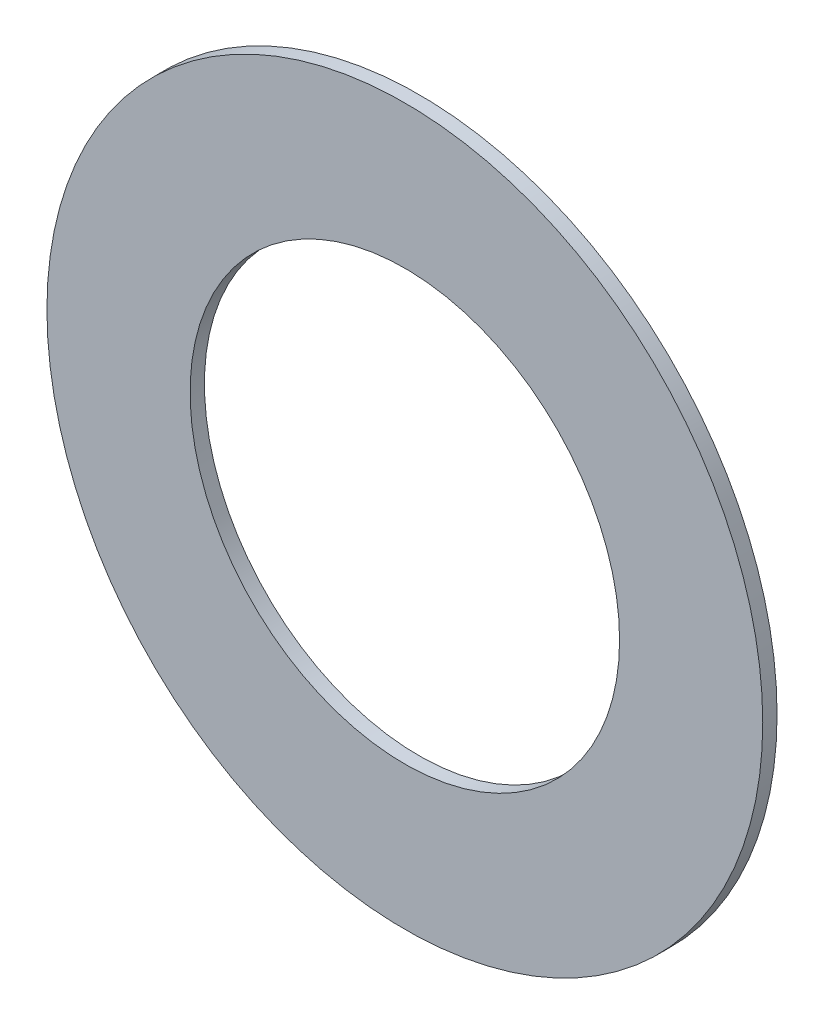
from build123d import *

# Parameters (mm, degrees)
SKETCH_1_R      = 2.5
SKETCH_1_R_2    = 1.5
EXTRUDE_1_DEPTH = 0.05


with BuildPart() as part:
    # 草图1 → 凸台-拉伸1 (new, symmetric)
    with BuildSketch(Plane.XY):
        Circle(SKETCH_1_R)
        Circle(SKETCH_1_R_2, mode=Mode.SUBTRACT)
    extrude(amount=EXTRUDE_1_DEPTH, both=True)


solid = part.part
